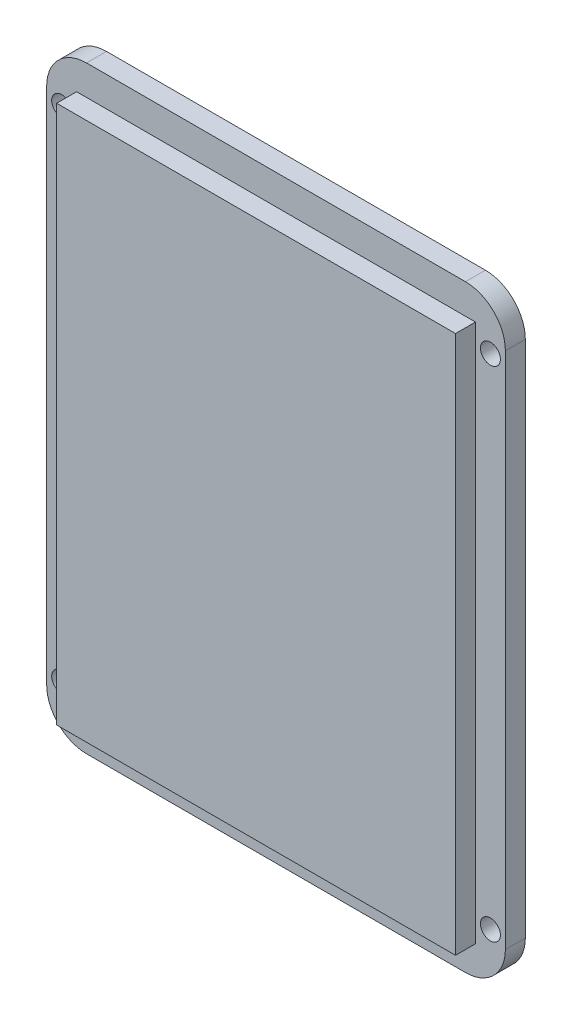
from build123d import *

# Parameters (mm, degrees)
ESQUISSE1_W             = 40
ESQUISSE1_H             = 54
BOSS_EXTRU_1_DEPTH      = 4
ESQUISSE2_W             = 46
ESQUISSE2_H             = 60
BOSS_EXTRU_2_DEPTH      = 2
CONG_1_R                = 4
ESQUISSE3_R             = 1
ENL_V_MAT_EXTRU_1_DEPTH = 76.709972923


with BuildPart() as part:
    # Esquisse1 → Boss.-Extru.1 (new body)
    with BuildSketch(Plane.XY):
        with Locations((23, 30)):
            Rectangle(ESQUISSE1_W, ESQUISSE1_H)
    extrude(amount=BOSS_EXTRU_1_DEPTH)

    # Esquisse2 → Boss.-Extru.2 (add)
    with BuildSketch(Plane.XY):
        with Locations((23, 30)):
            Rectangle(ESQUISSE2_W, ESQUISSE2_H)
    extrude(amount=BOSS_EXTRU_2_DEPTH)

    # Congé1
    cong_1_edges = [part.edges().sort_by_distance(p)[0] for p in [
        (0, 60, 1),
        (0, 0, 1),
        (46, 0, 1),
        (46, 60, 1),
    ]]
    fillet(cong_1_edges, radius=CONG_1_R)

    # Esquisse3 → Enlèv. mat.-Extru.1 (cut, through all)
    with BuildSketch(Plane.XY):
        with Locations((44.5, 5)):
            Circle(ESQUISSE3_R)
        with Locations((1.5, 5)):
            Circle(ESQUISSE3_R)
        with Locations((1.5, 55)):
            Circle(ESQUISSE3_R)
        with Locations((44.5, 55)):
            Circle(ESQUISSE3_R)
    extrude(amount=ENL_V_MAT_EXTRU_1_DEPTH, mode=Mode.SUBTRACT)


solid = part.part
